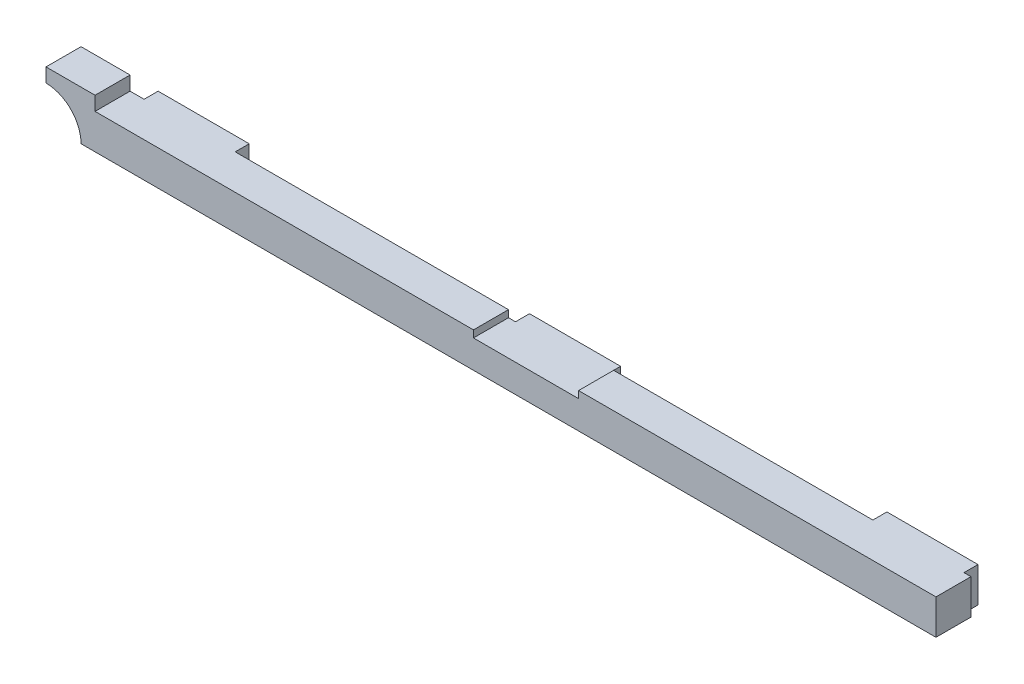
from build123d import *

# Parameters (mm, degrees)
BOSS_EXTRU_1_DEPTH = 5
ESQUISSE1_W        = 13
ESQUISSE1_H        = 5
ESQUISSE1_H_2      = 4
BOSS_EXTRU_2_DEPTH = 2


with BuildPart() as part:
    # Base pièce → Boss.-Extru.1 (new body)
    with BuildSketch(Plane.XY):
        with BuildLine():
            Line((0, 0), (15, 0))
            Line((15, 0), (15, 1))
            Line((15, 1), (66, 1))
            Line((66, 1), (66, -4))
            Line((66, -4), (-56, -4))
            ThreePointArc((-56, -4), (-57.464466094, -0.464466094), (-61, 1))
            Line((-61, 1), (-61, 3))
            Line((-61, 3), (-54, 3))
            Line((-54, 3), (-54, 1))
            Line((-54, 1), (0, 1))
            Line((0, 1), (0, 0))
        make_face()
    extrude(amount=BOSS_EXTRU_1_DEPTH)

    # Esquisse1 → Boss.-Extru.2 (add)
    with BuildSketch(Plane(origin=(0, 0, 0), x_dir=(-1, 0, 0), z_dir=(0, 0, -1))):
        with Locations((-58.5, -1.5)):
            Rectangle(ESQUISSE1_W, ESQUISSE1_H)
        with Locations((-7.5, -2)):
            Rectangle(ESQUISSE1_W, ESQUISSE1_H_2)
        with Locations((45.5, -1.5)):
            Rectangle(ESQUISSE1_W, ESQUISSE1_H)
    extrude(amount=BOSS_EXTRU_2_DEPTH)


solid = part.part
